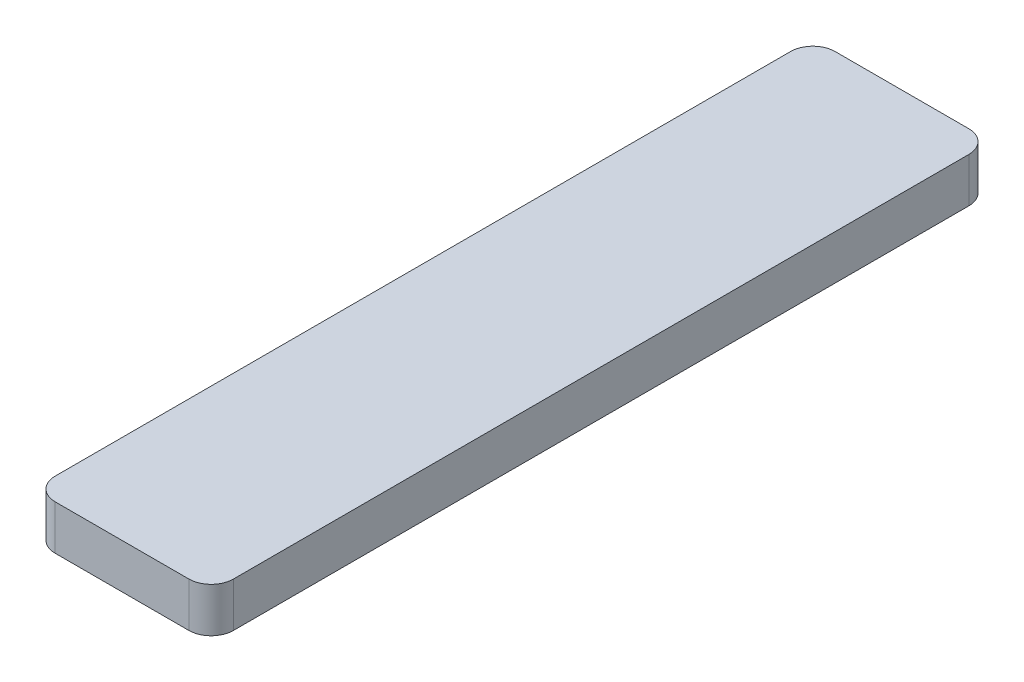
from build123d import *

# Parameters (mm, degrees)
SKETCH_1_W      = 16
SKETCH_1_H      = 70
EXTRUDE_1_DEPTH = 4
FILLET_1_R      = 2


with BuildPart() as part:
    # 草图1 → 凸台-拉伸1 (new body)
    with BuildSketch(Plane(origin=(0, 0, 0), x_dir=(1, 0, 0), z_dir=(0, 1, 0))):
        Rectangle(SKETCH_1_W, SKETCH_1_H)
    extrude(amount=EXTRUDE_1_DEPTH)

    # 圆角1
    fillet_1_edges = [part.edges().sort_by_distance(p)[0] for p in [
        (-8, 2, -35),
        (8, 2, -35),
        (8, 2, 35),
        (-8, 2, 35),
    ]]
    fillet(fillet_1_edges, radius=FILLET_1_R)


solid = part.part
